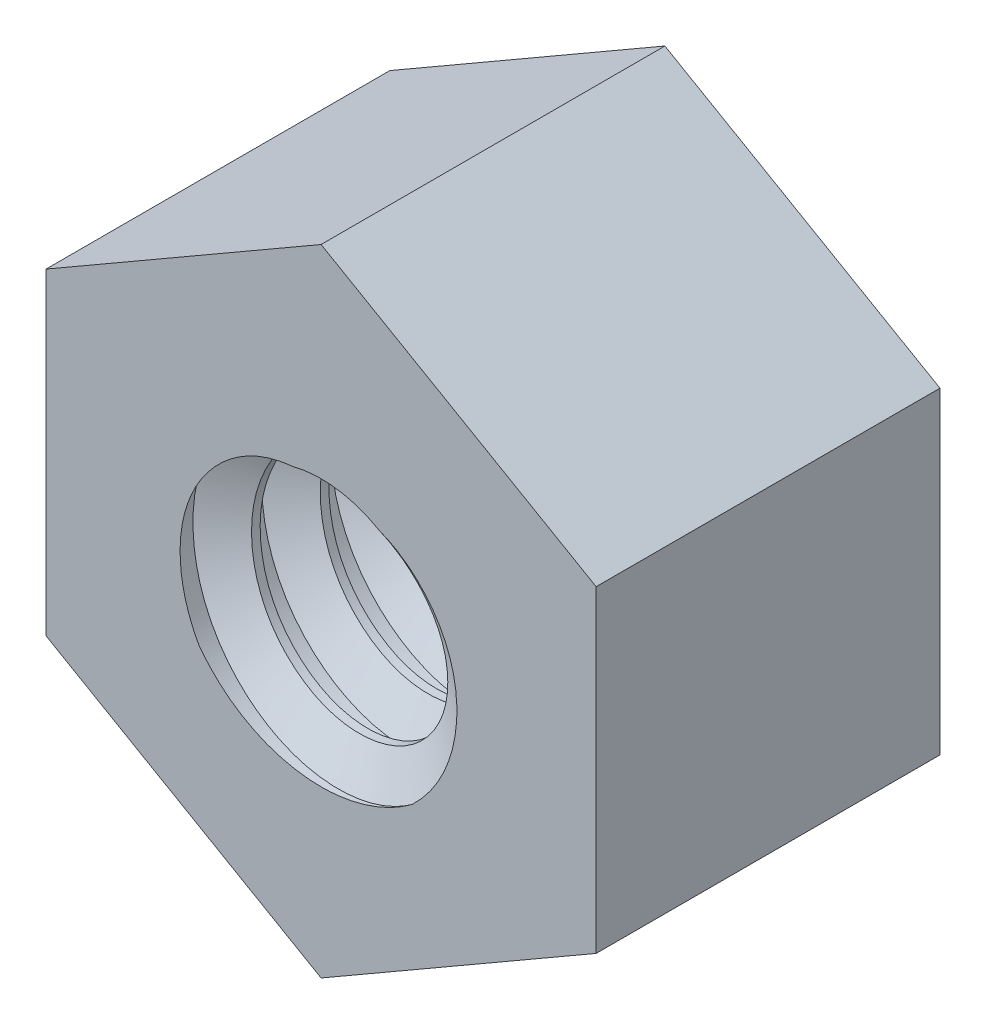
from build123d import *
from build123d.topology import SkipClean

# Parameters (mm, degrees)
SKETCH2_R           = 1.67
BOSS_EXTRUDE1_DEPTH = 5
THREAD1_PITCH       = 1
THREAD1_HEIGHT      = 15
THREAD1_RADIUS      = 1.67


with BuildPart() as part:
    # Sketch2 → Boss-Extrude1 (new body)
    with BuildSketch(Plane.XY):
        Polygon((0, -4.618802154), (4, -2.309401077), (4, 2.309401077), (0, 4.618802154), (-4, 2.309401077), (-4, -2.309401077), align=None)
        Circle(SKETCH2_R, mode=Mode.SUBTRACT)
    extrude(amount=-BOSS_EXTRUDE1_DEPTH)

    # Thread1: sweep along a helix
    with SkipClean():  # the faces are left unmerged after this step: merging them gives an invalid solid
        with BuildLine() as thread1_path:
            Helix(THREAD1_PITCH, THREAD1_HEIGHT, THREAD1_RADIUS, center=(0, 0, -7.165577799), direction=(0, 0, 1))
        # Thread Profile2 → Thread1 (sweep, cut)
        with BuildSketch(Plane(origin=(1.67, 0, -7.165577799), x_dir=(-1, 0, 0), z_dir=(0, 1, 0))):
            Polygon((0, 0), (0, 0.874999997), (-0.541265875, 0.562499999), (-0.541265875, 0.312499999), align=None)
        sweep(path=thread1_path.line, is_frenet=True, mode=Mode.SUBTRACT)


solid = part.part
